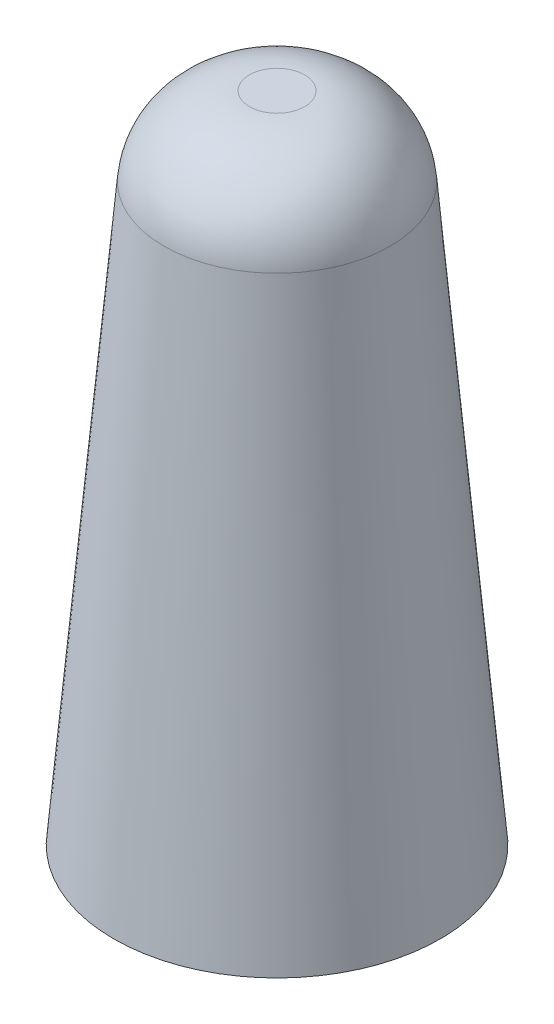
from build123d import *

# Parameters (mm, degrees)
CROQUIS1_R              = 19.05
SALIENTE_EXTRUIR1_DEPTH = 76.2
SALIENTE_EXTRUIR1_TAPER = 5
REDONDEO1_R             = 10


with BuildPart() as part:
    # Croquis1 → Saliente-Extruir1 (new body)
    with BuildSketch(Plane(origin=(0, 0, 0), x_dir=(1, 0, 0), z_dir=(0, 1, 0))):
        Circle(CROQUIS1_R)
    extrude(amount=SALIENTE_EXTRUIR1_DEPTH, taper=SALIENTE_EXTRUIR1_TAPER)

    # Redondeo1
    redondeo1_edges = [part.edges().sort_by_distance(p)[0] for p in [
        (-12.383363839, 76.2, 0),
    ]]
    fillet(redondeo1_edges, radius=REDONDEO1_R)


solid = part.part
